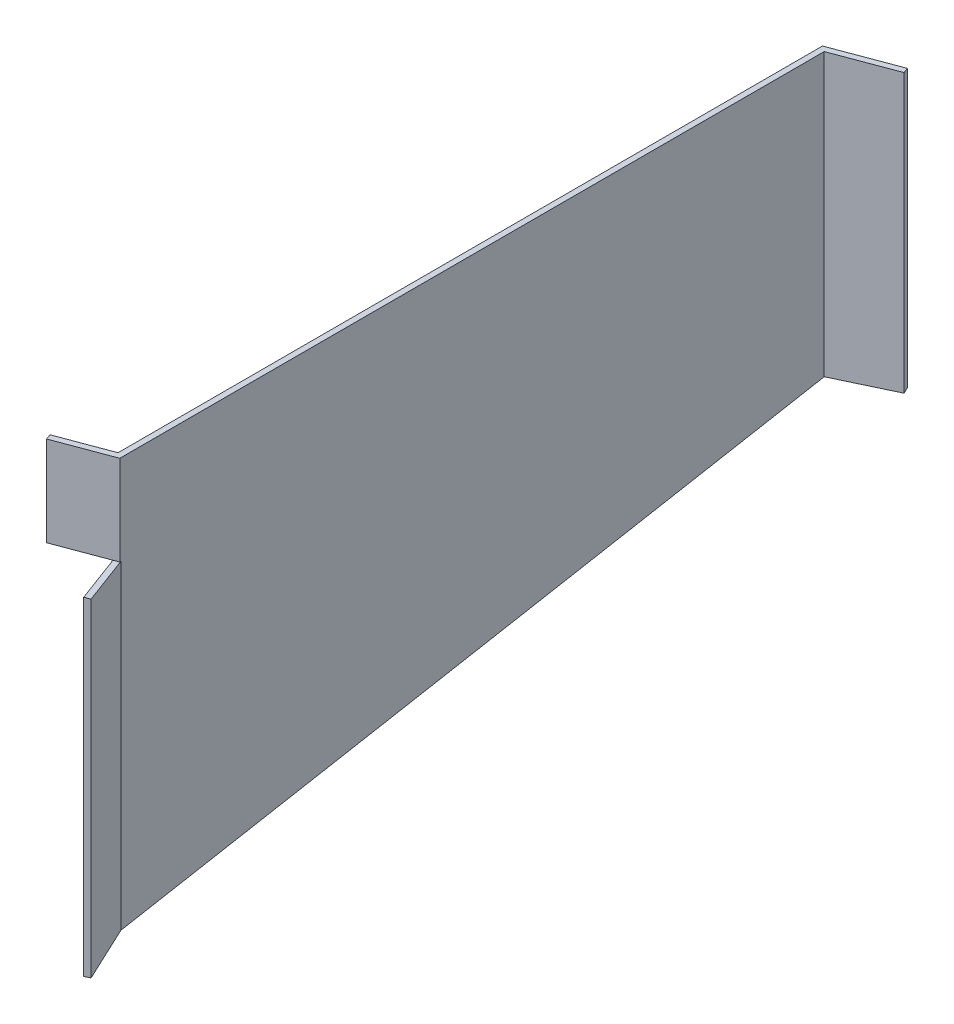
from build123d import *

# Parameters (mm, degrees)
SKETCH1_W           = 3.175
SKETCH1_H           = 395.409928
BOSS_EXTRUDE1_DEPTH = 228.6
CUT_EXTRUDE1_DEPTH  = 457.746156838
BOSS_EXTRUDE4_REACH = 458.746
BOSS_EXTRUDE5_DEPTH = 50.165
BOSS_EXTRUDE8_REACH = 449.004


with BuildPart() as part:
    # Sketch1 → Boss-Extrude1 (new body)
    with BuildSketch(Plane(origin=(0, 0, 0), x_dir=(1, 0, 0), z_dir=(0, 1, 0))):
        with Locations((1.5875, 197.704964)):
            Rectangle(SKETCH1_W, SKETCH1_H)
    extrude(amount=BOSS_EXTRUDE1_DEPTH)

    # Sketch2 → Cut-Extrude1 (cut, through all)
    with BuildSketch(Plane(origin=(3.175, 0, 0), x_dir=(0, 0, -1), z_dir=(1, 0, 0))):
        Polygon((0, 0), (395.409928, 71.795894), (395.409928, 0), align=None)
    extrude(amount=-CUT_EXTRUDE1_DEPTH, mode=Mode.SUBTRACT)

    # Boss-Extrude4: up to this plane
    boss_extrude4_end = Plane(origin=(0, 0, 0), z_dir=(0, 0.9839122845611679, 0.17865222161961358))
    # Sketch8 → Boss-Extrude4 (add, up to the surface)
    with BuildSketch(Plane(origin=(0, 228.6, 0), x_dir=(1, 0, 0), z_dir=(0, 1, 0)), mode=Mode.PRIVATE) as boss_extrude4_sk1:
        Polygon((0, 395.409928), (34.502136928, 408.296023119), (35.613007197, 405.32170097), (0, 392.020710392), align=None)
    boss_extrude4_tool1 = split(extrude(boss_extrude4_sk1.sketch, amount=-BOSS_EXTRUDE4_REACH, mode=Mode.PRIVATE), bisect_by=boss_extrude4_end, keep=Keep.BOTH, mode=Mode.PRIVATE)
    add(boss_extrude4_tool1.solids().sort_by_distance((17.530253, 228.6, -400.253689))[0])

    # Sketch9 → Boss-Extrude5 (add)
    with BuildSketch(Plane(origin=(0, 228.6, 0), x_dir=(1, 0, 0), z_dir=(0, 1, 0))):
        Polygon((3.175, 0), (-26.568221489, -11.108702689), (-27.679091758, -8.13438054), (3.175, 3.389217608), align=None)
    extrude(amount=-BOSS_EXTRUDE5_DEPTH)

    # Boss-Extrude8: up to this plane
    boss_extrude8_end = Plane(origin=(0, 0, 0), z_dir=(0, 0.9839122845611679, 0.17865222161961358))
    # Sketch13 → Boss-Extrude8 (add, up to the surface)
    with BuildSketch(Plane.XZ.offset(-178.435), mode=Mode.PRIVATE) as boss_extrude8_sk1:
        Polygon((0, 0), (10.106509579, 27.059879205), (13.080831728, 25.949008936), (1.972129039, -3.794212553), align=None)
    boss_extrude8_tool1 = split(extrude(boss_extrude8_sk1.sketch, amount=BOSS_EXTRUDE8_REACH, mode=Mode.PRIVATE), bisect_by=boss_extrude8_end, keep=Keep.BOTH, mode=Mode.PRIVATE)
    add(boss_extrude8_tool1.solids().sort_by_distance((6.30934, 178.435, 12.284359))[0])


solid = part.part
